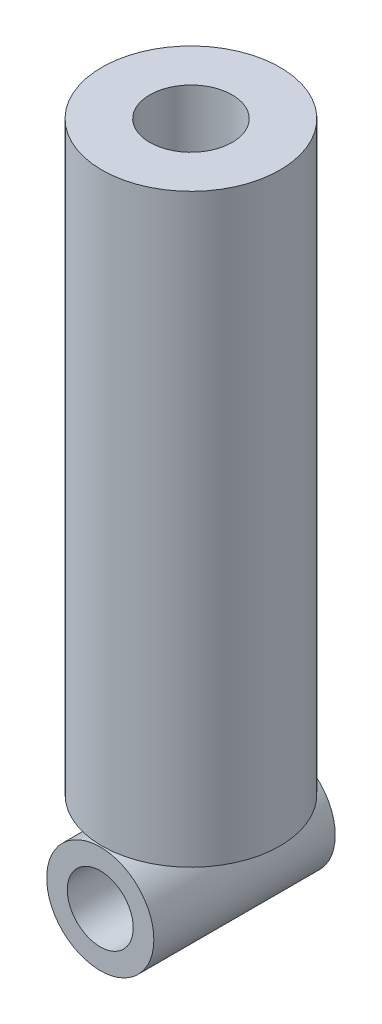
from build123d import *

# Parameters (mm, degrees)
SKETCH_1_R          = 54
EXTRUDE_1_DEPTH     = 355
SKETCH_2_R          = 25
CUT_EXTRUDE_1_DEPTH = 340
SKETCH_3_R          = 32.5
SKETCH_3_R_2        = 20
EXTRUDE_2_DEPTH     = 55


with BuildPart() as part:
    # 草图1 → 凸台-拉伸1 (new body)
    with BuildSketch(Plane(origin=(0, 0, 0), x_dir=(1, 0, 0), z_dir=(0, 1, 0))):
        with Locations(Location((0, 0, 0), (0, 0, 270))):
            Circle(SKETCH_1_R)
    extrude(amount=EXTRUDE_1_DEPTH)

    # 草图2 → 切除-拉伸1 (cut)
    with BuildSketch(Plane(origin=(0, 355, 0), x_dir=(1, 0, 0), z_dir=(0, 1, 0))):
        with Locations(Location((0, 0, 0), (0, 0, 270))):
            Circle(SKETCH_2_R)
    extrude(amount=-CUT_EXTRUDE_1_DEPTH, mode=Mode.SUBTRACT)


with BuildPart() as body_2:
    # 草图3 → 凸台-拉伸2 (new, symmetric)
    with BuildSketch(Plane.XY):
        with Locations((0, -32.5)):
            Circle(SKETCH_3_R)
        with Locations((0, -32.5)):
            Circle(SKETCH_3_R_2, mode=Mode.SUBTRACT)
    extrude(amount=EXTRUDE_2_DEPTH, both=True)


solid = Compound([part.part, body_2.part])
